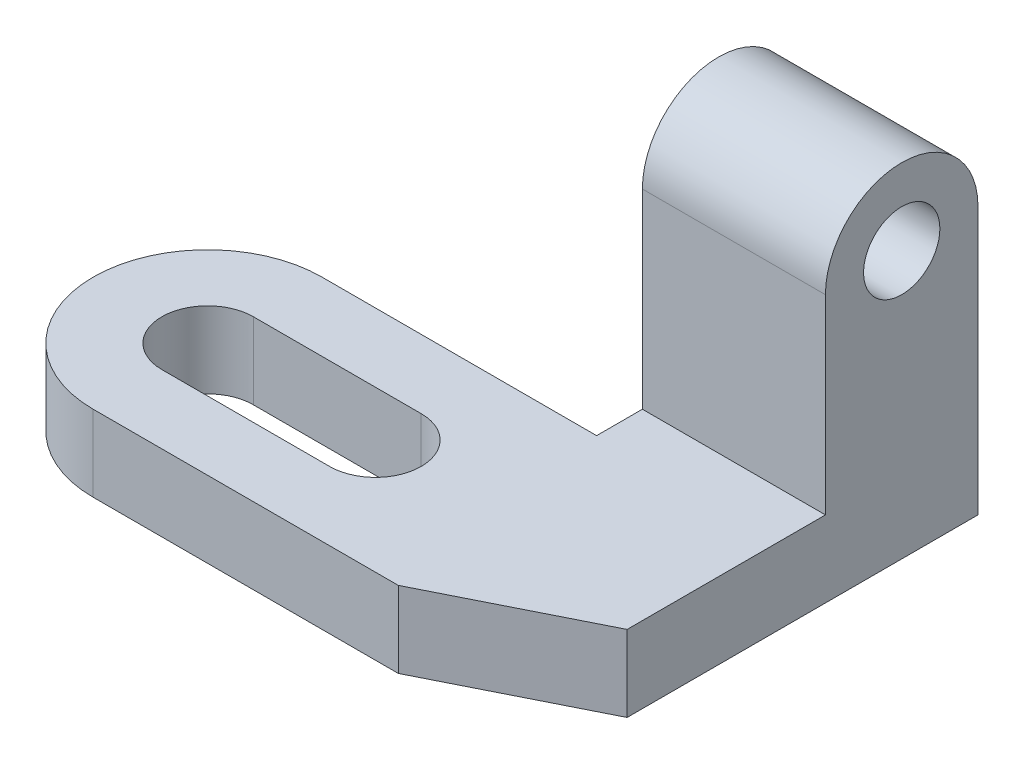
from build123d import *

# Parameters (mm, degrees)
EXTRUDE_1_DEPTH = 10
SKETCH_3_R      = 5
EXTRUDE_2_DEPTH = 24


with BuildPart() as part:
    # 草图1 → 凸台-拉伸1 (new body)
    with BuildSketch(Plane(origin=(0, 0, 0), x_dir=(1, 0, 0), z_dir=(0, 1, 0))):
        with BuildLine():
            Line((0, 15), (36, 15))
            Line((36, 15), (36, 41))
            Line((36, 41), (60, 41))
            Line((60, 41), (60, -5))
            Line((60, -5), (40, -15))
            Line((40, -15), (0, -15))
            ThreePointArc((0, -15), (-15, 0), (0, 15))
        make_face()
        with BuildLine():
            Line((0, 6), (22, 6))
            ThreePointArc((22, 6), (28, 0), (22, -6))
            Line((22, -6), (0, -6))
            ThreePointArc((0, -6), (-6, 0), (0, 6))
        make_face(mode=Mode.SUBTRACT)
    extrude(amount=EXTRUDE_1_DEPTH)

    # 草图3 → 凸台-拉伸2 (add)
    with BuildSketch(Plane(origin=(60, 0, 0), x_dir=(0, 0, -1), z_dir=(1, 0, 0))):
        with BuildLine():
            Line((41, 10), (21, 10))
            Line((21, 10), (21, 35))
            ThreePointArc((21, 35), (31, 45), (41, 35))
            Line((41, 35), (41, 10))
        make_face()
        with Locations((31, 35)):
            Circle(SKETCH_3_R, mode=Mode.SUBTRACT)
    extrude(amount=-EXTRUDE_2_DEPTH)


solid = part.part
